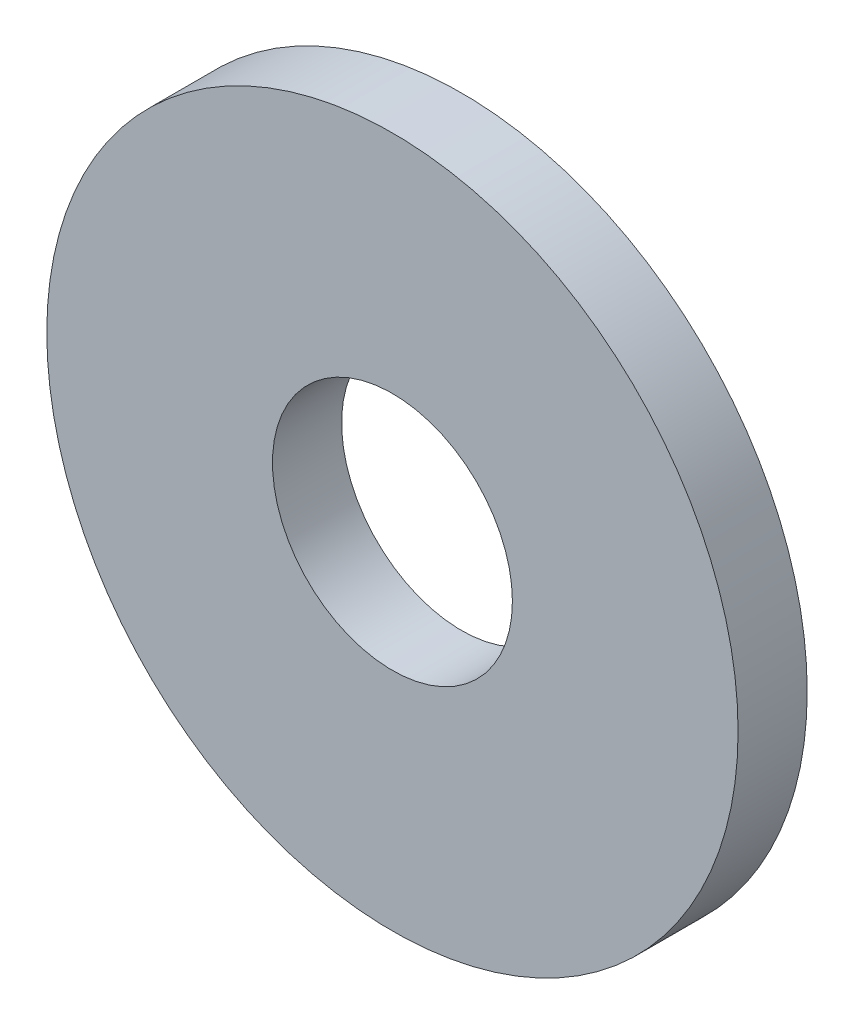
from build123d import *

# Parameters (mm, degrees)
SKETCH1_R           = 8.5
SKETCH1_R_2         = 2.95
BOSS_EXTRUDE1_DEPTH = 1.7


with BuildPart() as part:
    # Sketch1 → Boss-Extrude1 (new body)
    with BuildSketch(Plane.XY):
        Circle(SKETCH1_R)
        Circle(SKETCH1_R_2, mode=Mode.SUBTRACT)
    extrude(amount=BOSS_EXTRUDE1_DEPTH)


solid = part.part
